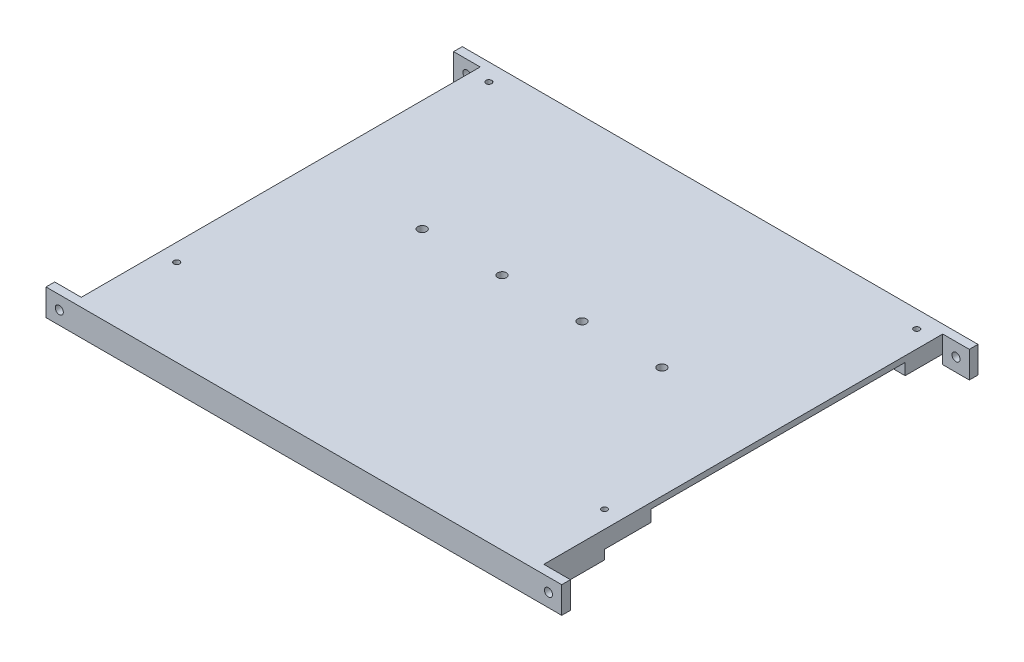
from build123d import *

# Parameters (mm, degrees)
SKETCH_1_W          = 80
SKETCH_1_H          = 3
EXTRUDE_1_DEPTH     = 60
SKETCH_4_R          = 0.5
CUT_EXTRUDE_1_DEPTH = 73.173402303
SKETCH_5_W          = 64
SKETCH_5_H          = 6
SKETCH_5_W_2        = 6
SKETCH_5_H_2        = 44
CUT_EXTRUDE_4_DEPTH = 2
EXTRUDE_START       = -60
SKETCH_6_R          = 0.7
EXTRUDE_2_DEPTH     = 1.5
EXTRUDE_3_DEPTH     = 12
EXTRUDE_START_2     = 10.5
SKETCH_6_4_R        = 0.7
EXTRUDE_4_DEPTH     = 1.5
SKETCH_7_R          = 0.75
CUT_EXTRUDE_5_DEPTH = 85.819337418


with BuildPart() as part:
    # 草图1 → 凸台-拉伸1 (new body)
    with BuildSketch(Plane.XY):
        Rectangle(SKETCH_1_W, SKETCH_1_H)
    extrude(amount=EXTRUDE_1_DEPTH)

    # 草图4 → 切除-拉伸1 (cut, through all)
    with BuildSketch(Plane(origin=(0, 1.5, 0), x_dir=(1, 0, 0), z_dir=(0, 1, 0))):
        with Locations(Location((-37, -57, 0), (0, 0, 270))):
            Circle(SKETCH_4_R)
        with Locations(Location((37, -57, 0), (0, 0, 270))):
            Circle(SKETCH_4_R)
        with Locations(Location((-37, -3, 0), (0, 0, 270))):
            Circle(SKETCH_4_R)
        with Locations(Location((37, -3, 0), (0, 0, 270))):
            Circle(SKETCH_4_R)
    extrude(amount=-CUT_EXTRUDE_1_DEPTH, mode=Mode.SUBTRACT)

    # 草图5 → 切除-拉伸4 (cut)
    with BuildSketch(Plane.XZ.offset(1.5)):
        with Locations((0, 57)):
            Rectangle(SKETCH_5_W, SKETCH_5_H)
        with Locations((37, 30)):
            Rectangle(SKETCH_5_W_2, SKETCH_5_H_2)
        with Locations((0, 3)):
            Rectangle(SKETCH_5_W, SKETCH_5_H)
        with Locations((-37, 30)):
            Rectangle(SKETCH_5_W_2, SKETCH_5_H_2)
    extrude(amount=-CUT_EXTRUDE_4_DEPTH, mode=Mode.SUBTRACT)

    # 草图6 → 凸台-拉伸2 (add)
    # profile 1 of 2: a face of its own
    with BuildSketch(Plane.XY.offset(60).offset(EXTRUDE_START)):
        Polygon((-40, -1.5), (-40, 1.5), (-44.6, 1.5), (-44.6, -3.1), (-40, -3.1), align=None)
        with Locations((-42.3, -0.8)):
            Circle(SKETCH_6_R, mode=Mode.SUBTRACT)
    # profile 2 of 2: a face of its own
    with BuildSketch(Plane.XY.offset(60).offset(EXTRUDE_START)):
        Polygon((44.6, 1.5), (40, 1.5), (40, -1.5), (40, -3.1), (44.6, -3.1), align=None)
        with Locations((42.3, -0.8)):
            Circle(SKETCH_6_R, mode=Mode.SUBTRACT)
    extrude(amount=EXTRUDE_2_DEPTH)

    # 草图6<3> → 凸台-拉伸3 (add)
    with BuildSketch(Plane.XY.offset(60)):
        Polygon((-32, -1.5), (-40, -1.5), (-40, -3.1), (40, -3.1), (40, -1.5), (32, -1.5), (32, 0.5), (-32, 0.5), align=None)
        Polygon((-40, -1.5), (-32, -1.5), (-32, 0.5), (32, 0.5), (32, -1.5), (40, -1.5), (40, 1.5), (-40, 1.5), align=None)
    extrude(amount=EXTRUDE_3_DEPTH)

    # 草图6<4> → 凸台-拉伸4 (add)
    # profile 1 of 2: a face of its own
    with BuildSketch(Plane.XY.offset(60).offset(EXTRUDE_START_2)):
        Polygon((-40, -1.5), (-40, 1.5), (-44.6, 1.5), (-44.6, -3.1), (-40, -3.1), align=None)
        with Locations((-42.3, -0.8)):
            Circle(SKETCH_6_4_R, mode=Mode.SUBTRACT)
    # profile 2 of 2: a face of its own
    with BuildSketch(Plane.XY.offset(60).offset(EXTRUDE_START_2)):
        Polygon((44.6, 1.5), (40, 1.5), (40, -1.5), (40, -3.1), (44.6, -3.1), align=None)
        with Locations((42.3, -0.8)):
            Circle(SKETCH_6_4_R, mode=Mode.SUBTRACT)
    extrude(amount=EXTRUDE_4_DEPTH)

    # 草图7 → 切除-拉伸5 (cut, through all)
    with BuildSketch(Plane(origin=(0, 1.5, 0), x_dir=(1, 0, 0), z_dir=(0, 1, 0))):
        with Locations(Location((20.7375, -30.8, 0), (0, 0, 270))):
            Circle(SKETCH_7_R)
        with Locations(Location((6.9125, -30.8, 0), (0, 0, 270))):
            Circle(SKETCH_7_R)
        with Locations(Location((-6.9125, -30.8, 0), (0, 0, 270))):
            Circle(SKETCH_7_R)
        with Locations(Location((-20.7375, -30.8, 0), (0, 0, 270))):
            Circle(SKETCH_7_R)
    extrude(amount=-CUT_EXTRUDE_5_DEPTH, mode=Mode.SUBTRACT)


solid = part.part
